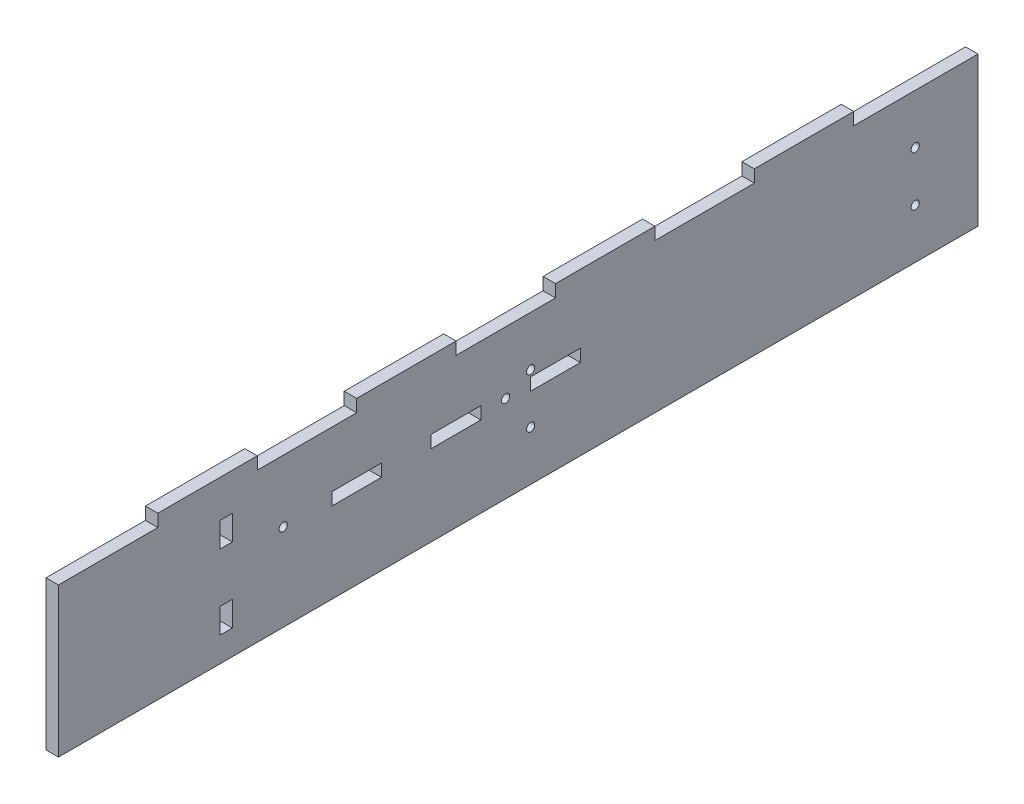
from build123d import *

# Parameters (mm, degrees)
SKETCH1_W           = 6.35
SKETCH1_H           = 76.2
BOSS_EXTRUDE1_DEPTH = 457.2
SKETCH2_W           = 6.35
SKETCH2_H           = 50.8
BOSS_EXTRUDE2_DEPTH = 6.35
SKETCH3_W           = 6.35
SKETCH3_H           = 12.7
CUT_EXTRUDE1_DEPTH  = 460.399570091
SKETCH7_R           = 2.0955
CUT_EXTRUDE2_DEPTH  = 460.399570091
SKETCH9_R           = 2.0955
SKETCH9_W           = 25.4
SKETCH9_H           = 6.35
CUT_EXTRUDE3_DEPTH  = 6.35
SKETCH11_W          = 6.35
SKETCH11_H          = 76.2
BOSS_EXTRUDE5_DEPTH = 12.7


with BuildPart() as part:
    # Sketch1 → Boss-Extrude1 (new body)
    with BuildSketch(Plane.XY):
        with Locations((-41.275, 0)):
            Rectangle(SKETCH1_W, SKETCH1_H)
    extrude(amount=-BOSS_EXTRUDE1_DEPTH)

    # Sketch2 → Boss-Extrude2 (add)
    with BuildSketch(Plane(origin=(0, 38.1, 0), x_dir=(1, 0, 0), z_dir=(0, 1, 0))):
        with Locations((-41.275, 381)):
            Rectangle(SKETCH2_W, SKETCH2_H)
        with Locations((-41.275, 279.4)):
            Rectangle(SKETCH2_W, SKETCH2_H)
        with Locations((-41.275, 177.8)):
            Rectangle(SKETCH2_W, SKETCH2_H)
        with Locations((-41.275, 76.2)):
            Rectangle(SKETCH2_W, SKETCH2_H)
    extrude(amount=BOSS_EXTRUDE2_DEPTH)

    # Sketch3 → Cut-Extrude1 (cut, through all)
    with BuildSketch(Plane(origin=(-38.1, 0, 0), x_dir=(0, 0, -1), z_dir=(1, 0, 0))):
        with Locations((85.725, 19.05)):
            Rectangle(SKETCH3_W, SKETCH3_H)
        with Locations((85.725, -19.05)):
            Rectangle(SKETCH3_W, SKETCH3_H)
    extrude(amount=-CUT_EXTRUDE1_DEPTH, mode=Mode.SUBTRACT)

    # Sketch7 → Cut-Extrude2 (cut, through all)
    with BuildSketch(Plane.ZY.offset(44.45)):
        with Locations((-241.3, -12.7)):
            Circle(SKETCH7_R)
        with Locations((-241.3, 12.7)):
            Circle(SKETCH7_R)
        with Locations((-437.8325, -12.7)):
            Circle(SKETCH7_R)
        with Locations((-437.8325, 12.7)):
            Circle(SKETCH7_R)
    extrude(amount=-CUT_EXTRUDE2_DEPTH, mode=Mode.SUBTRACT)

    # Sketch9 → Cut-Extrude3 (cut)
    with BuildSketch(Plane.ZY.offset(44.45)):
        with Locations((-114.880216651, 6.35)):
            Circle(SKETCH9_R)
        with Locations((-228.517018256, 6.35)):
            Circle(SKETCH9_R)
        with Locations((-254, 6.35)):
            Rectangle(SKETCH9_W, SKETCH9_H)
        with Locations((-203.2, 6.35)):
            Rectangle(SKETCH9_W, SKETCH9_H)
        with Locations((-152.4, 6.35)):
            Rectangle(SKETCH9_W, SKETCH9_H)
    extrude(amount=-CUT_EXTRUDE3_DEPTH, mode=Mode.SUBTRACT)

    # Sketch11 → Boss-Extrude5 (add)
    with BuildSketch(Plane(origin=(0, 0, -457.2), x_dir=(-1, 0, 0), z_dir=(0, 0, -1))):
        with Locations((41.275, 0)):
            Rectangle(SKETCH11_W, SKETCH11_H)
    extrude(amount=BOSS_EXTRUDE5_DEPTH)


solid = part.part
